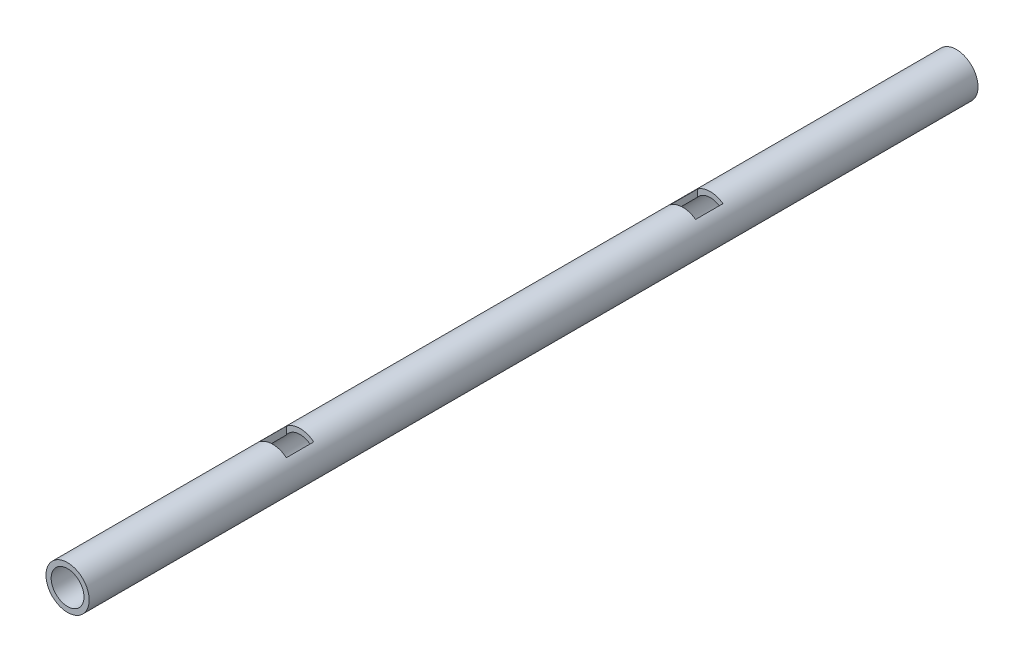
from build123d import *

# Parameters (mm, degrees)
CROQUIS1_R                 = 7.9
SALIENTE_EXTRUIR1_DEPTH    = 162.5
CROQUIS3_R                 = 6
CORTAR_EXTRUIR1_DEPTH      = 326.191974071
CORTAR_EXTRUIR2_REACH      = 164.884
CORTAR_EXTRUIR2_END_RADIUS = 7.9
CROQUIS4_W                 = 10
CROQUIS4_H                 = 10
CORTAR_EXTRUIR3_REACH      = 164.884
CORTAR_EXTRUIR3_END_RADIUS = 7.9
CROQUIS5_W                 = 9.290487028
CROQUIS5_H                 = 10


with BuildPart() as part:
    # Croquis1 → Saliente-Extruir1 (new, symmetric)
    with BuildSketch(Plane.XY):
        Circle(CROQUIS1_R)
    extrude(amount=SALIENTE_EXTRUIR1_DEPTH, both=True)

    # Croquis3 → Cortar-Extruir1 (cut, through all)
    with BuildSketch(Plane.XY.offset(162.5)):
        Circle(CROQUIS3_R)
    extrude(amount=-CORTAR_EXTRUIR1_DEPTH, mode=Mode.SUBTRACT)

    # Cortar-Extruir2: up to this cylinder (the profile starts inside it)
    cortar_extruir2_end = Plane(origin=(0, 0, 82.5), z_dir=(0, 0, -1)) * Cylinder(CORTAR_EXTRUIR2_END_RADIUS, 346.568, mode=Mode.PRIVATE)
    # Croquis4 → Cortar-Extruir2 (cut, up to the surface)
    with BuildSketch(Plane(origin=(0, 0, 0), x_dir=(1, 0, 0), z_dir=(0, 1, 0)), mode=Mode.PRIVATE) as cortar_extruir2_sk1:
        with Locations((0, -82.5)):
            Rectangle(CROQUIS4_W, CROQUIS4_H)
    cortar_extruir2_tool1 = extrude(cortar_extruir2_sk1.sketch, amount=CORTAR_EXTRUIR2_REACH, mode=Mode.PRIVATE) & cortar_extruir2_end
    add(cortar_extruir2_tool1.solids().sort_by_distance((0, 0, 82.5))[0], mode=Mode.SUBTRACT)

    # Cortar-Extruir3: up to this cylinder (the profile starts inside it)
    cortar_extruir3_end = Plane(origin=(0, 0, -67.5), z_dir=(0, 0, -1)) * Cylinder(CORTAR_EXTRUIR3_END_RADIUS, 346.568, mode=Mode.PRIVATE)
    # Croquis5 → Cortar-Extruir3 (cut, up to the surface)
    with BuildSketch(Plane(origin=(0, 0, 0), x_dir=(1, 0, 0), z_dir=(0, 1, 0)), mode=Mode.PRIVATE) as cortar_extruir3_sk1:
        with Locations((0, 67.5)):
            Rectangle(CROQUIS5_W, CROQUIS5_H)
    cortar_extruir3_tool1 = extrude(cortar_extruir3_sk1.sketch, amount=CORTAR_EXTRUIR3_REACH, mode=Mode.PRIVATE) & cortar_extruir3_end
    add(cortar_extruir3_tool1.solids().sort_by_distance((0, 0, -67.5))[0], mode=Mode.SUBTRACT)


solid = part.part
